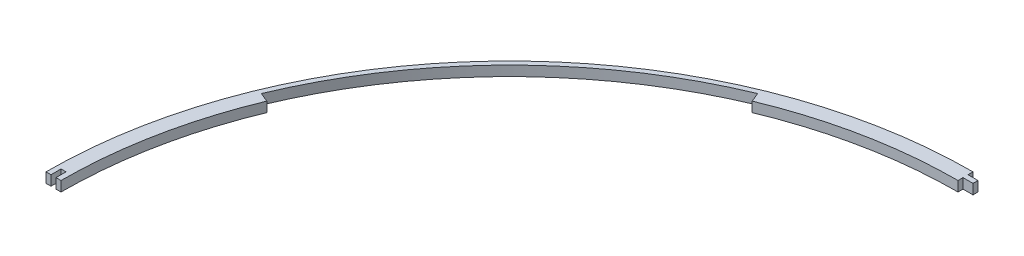
from build123d import *

# Parameters (mm, degrees)
BOSS_EXTRUDE1_DEPTH = 6.35


with BuildPart() as part:
    # Sketch1 → Boss-Extrude1 (new body)
    with BuildSketch(Plane(origin=(0, 0, 0), x_dir=(1, 0, 0), z_dir=(0, 1, 0))):
        with BuildLine():
            ThreePointArc((-109.011585227, 263.177247511), (-55.57362422, 279.387475761), (0, 284.861))
            Line((0, 284.861), (0, 288.036))
            Line((0, 288.036), (6.35, 288.036))
            Line((6.35, 288.036), (6.35, 291.211))
            Line((6.35, 291.211), (0, 291.211))
            Line((0, 291.211), (0, 294.386))
            ThreePointArc((0, 294.386), (-57.431859537, 288.729455557), (-112.65664492, 271.977200058))
            Line((-112.65664492, 271.977200058), (-111.441625022, 269.043882542))
            Line((-111.441625022, 269.043882542), (-109.011585227, 263.177247511))
        make_face()
        with BuildLine():
            ThreePointArc((-269.043882542, 111.441625022), (-205.917272856, 205.917272856), (-111.441625022, 269.043882542))
            Line((-111.441625022, 269.043882542), (-112.65664492, 271.977200058))
            ThreePointArc((-112.65664492, 271.977200058), (-208.162336886, 208.162336886), (-271.977200058, 112.65664492))
            Line((-271.977200058, 112.65664492), (-269.043882542, 111.441625022))
        make_face()
        with BuildLine():
            Line((-263.177247511, 109.011585227), (-269.043882542, 111.441625022))
            Line((-269.043882542, 111.441625022), (-271.977200058, 112.65664492))
            ThreePointArc((-271.977200058, 112.65664492), (-288.729455557, 57.431859537), (-294.386, 0))
            Line((-294.386, 0), (-291.211, 0))
            Line((-291.211, 0), (-291.211, 6.35))
            Line((-291.211, 6.35), (-288.036, 6.35))
            Line((-288.036, 6.35), (-288.036, 0))
            Line((-288.036, 0), (-284.861, 0))
            ThreePointArc((-284.861, 0), (-279.387475761, 55.57362422), (-263.177247511, 109.011585227))
        make_face()
    extrude(amount=BOSS_EXTRUDE1_DEPTH)


solid = part.part
